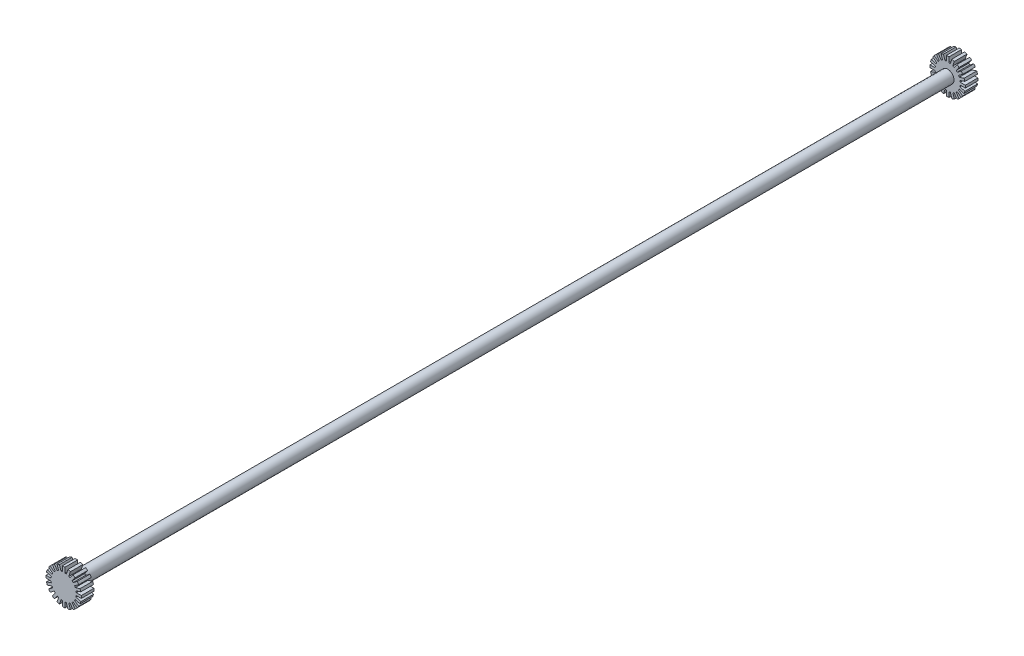
from build123d import *

# Parameters (mm, degrees)
SKETCH1_R           = 0.75
BOSS_EXTRUDE1_DEPTH = 0.5
SKETCH2_R           = 0.25
BOSS_EXTRUDE2_DEPTH = 34.5
SKETCH3_R           = 0.75
BOSS_EXTRUDE3_DEPTH = 0.5
SKETCH4_R           = 0.86249455
CUT_EXTRUDE1_DEPTH  = 42
SKETCH5_R           = 1.112534971
SKETCH5_R_2         = 0.7
CUT_EXTRUDE2_DEPTH  = 51


with BuildPart() as part:
    # Sketch1 → Boss-Extrude1 (new body)
    with BuildSketch(Plane.XY):
        Circle(SKETCH1_R)
    extrude(amount=BOSS_EXTRUDE1_DEPTH)

    # Sketch2 → Boss-Extrude2 (add)
    with BuildSketch(Plane.XY.offset(0.5)):
        Circle(SKETCH2_R)
    extrude(amount=BOSS_EXTRUDE2_DEPTH)

    # Sketch3 → Boss-Extrude3 (add)
    with BuildSketch(Plane.XY.offset(35)):
        Circle(SKETCH3_R)
    extrude(amount=BOSS_EXTRUDE3_DEPTH)

    # Sketch4 → Cut-Extrude1 (cut)
    with BuildSketch(Plane.XY.offset(35.5)):
        Circle(SKETCH4_R)
        with BuildLine():
            Line((-0.05, 0.75), (0.05, 0.75))
            Line((0.05, 0.75), (0.05, 0.497493719))
            ThreePointArc((0.05, 0.497493719), (0.078217233, 0.49384417), (0.106181188, 0.488595493))
            Line((0.106181188, 0.488595493), (0.18420992, 0.728743237))
            Line((0.18420992, 0.728743237), (0.279315572, 0.697841538))
            Line((0.279315572, 0.697841538), (0.201286839, 0.457693793))
            ThreePointArc((0.201286839, 0.457693793), (0.22699525, 0.445503262), (0.251968621, 0.431870136))
            Line((0.251968621, 0.431870136), (0.40038809, 0.636152008))
            Line((0.40038809, 0.636152008), (0.481289789, 0.577373483))
            Line((0.481289789, 0.577373483), (0.332870321, 0.37309161))
            ThreePointArc((0.332870321, 0.37309161), (0.353553391, 0.353553391), (0.37309161, 0.332870321))
            Line((0.37309161, 0.332870321), (0.577373483, 0.481289789))
            Line((0.577373483, 0.481289789), (0.636152008, 0.40038809))
            Line((0.636152008, 0.40038809), (0.431870136, 0.251968621))
            ThreePointArc((0.431870136, 0.251968621), (0.445503262, 0.22699525), (0.457693793, 0.201286839))
            Line((0.457693793, 0.201286839), (0.697841538, 0.279315572))
            Line((0.697841538, 0.279315572), (0.728743237, 0.18420992))
            Line((0.728743237, 0.18420992), (0.488595493, 0.106181188))
            ThreePointArc((0.488595493, 0.106181188), (0.49384417, 0.078217233), (0.497493719, 0.05))
            Line((0.497493719, 0.05), (0.75, 0.05))
            Line((0.75, 0.05), (0.75, -0.05))
            Line((0.75, -0.05), (0.497493719, -0.05))
            ThreePointArc((0.497493719, -0.05), (0.49384417, -0.078217233), (0.488595493, -0.106181188))
            Line((0.488595493, -0.106181188), (0.728743237, -0.18420992))
            Line((0.728743237, -0.18420992), (0.697841538, -0.279315572))
            Line((0.697841538, -0.279315572), (0.457693793, -0.201286839))
            ThreePointArc((0.457693793, -0.201286839), (0.445503262, -0.22699525), (0.431870136, -0.251968621))
            Line((0.431870136, -0.251968621), (0.636152008, -0.40038809))
            Line((0.636152008, -0.40038809), (0.577373483, -0.481289789))
            Line((0.577373483, -0.481289789), (0.37309161, -0.332870321))
            ThreePointArc((0.37309161, -0.332870321), (0.353553391, -0.353553391), (0.332870321, -0.37309161))
            Line((0.332870321, -0.37309161), (0.481289789, -0.577373483))
            Line((0.481289789, -0.577373483), (0.40038809, -0.636152008))
            Line((0.40038809, -0.636152008), (0.251968621, -0.431870136))
            ThreePointArc((0.251968621, -0.431870136), (0.22699525, -0.445503262), (0.201286839, -0.457693793))
            Line((0.201286839, -0.457693793), (0.279315572, -0.697841538))
            Line((0.279315572, -0.697841538), (0.18420992, -0.728743237))
            Line((0.18420992, -0.728743237), (0.106181188, -0.488595493))
            ThreePointArc((0.106181188, -0.488595493), (0.078217233, -0.49384417), (0.05, -0.497493719))
            Line((0.05, -0.497493719), (0.05, -0.75))
            Line((0.05, -0.75), (-0.05, -0.75))
            Line((-0.05, -0.75), (-0.05, -0.497493719))
            ThreePointArc((-0.05, -0.497493719), (-0.078217233, -0.49384417), (-0.106181188, -0.488595493))
            Line((-0.106181188, -0.488595493), (-0.18420992, -0.728743237))
            Line((-0.18420992, -0.728743237), (-0.279315572, -0.697841538))
            Line((-0.279315572, -0.697841538), (-0.201286839, -0.457693793))
            ThreePointArc((-0.201286839, -0.457693793), (-0.22699525, -0.445503262), (-0.251968621, -0.431870136))
            Line((-0.251968621, -0.431870136), (-0.40038809, -0.636152008))
            Line((-0.40038809, -0.636152008), (-0.481289789, -0.577373483))
            Line((-0.481289789, -0.577373483), (-0.332870321, -0.37309161))
            ThreePointArc((-0.332870321, -0.37309161), (-0.353553391, -0.353553391), (-0.37309161, -0.332870321))
            Line((-0.37309161, -0.332870321), (-0.577373483, -0.481289789))
            Line((-0.577373483, -0.481289789), (-0.636152008, -0.40038809))
            Line((-0.636152008, -0.40038809), (-0.431870136, -0.251968621))
            ThreePointArc((-0.431870136, -0.251968621), (-0.445503262, -0.22699525), (-0.457693793, -0.201286839))
            Line((-0.457693793, -0.201286839), (-0.697841538, -0.279315572))
            Line((-0.697841538, -0.279315572), (-0.728743237, -0.18420992))
            Line((-0.728743237, -0.18420992), (-0.488595493, -0.106181188))
            ThreePointArc((-0.488595493, -0.106181188), (-0.49384417, -0.078217233), (-0.497493719, -0.05))
            Line((-0.497493719, -0.05), (-0.75, -0.05))
            Line((-0.75, -0.05), (-0.75, 0.05))
            Line((-0.75, 0.05), (-0.497493719, 0.05))
            ThreePointArc((-0.497493719, 0.05), (-0.49384417, 0.078217233), (-0.488595493, 0.106181188))
            Line((-0.488595493, 0.106181188), (-0.728743237, 0.18420992))
            Line((-0.728743237, 0.18420992), (-0.697841538, 0.279315572))
            Line((-0.697841538, 0.279315572), (-0.457693793, 0.201286839))
            ThreePointArc((-0.457693793, 0.201286839), (-0.445503262, 0.22699525), (-0.431870136, 0.251968621))
            Line((-0.431870136, 0.251968621), (-0.636152008, 0.40038809))
            Line((-0.636152008, 0.40038809), (-0.577373483, 0.481289789))
            Line((-0.577373483, 0.481289789), (-0.37309161, 0.332870321))
            ThreePointArc((-0.37309161, 0.332870321), (-0.353553391, 0.353553391), (-0.332870321, 0.37309161))
            Line((-0.332870321, 0.37309161), (-0.481289789, 0.577373483))
            Line((-0.481289789, 0.577373483), (-0.40038809, 0.636152008))
            Line((-0.40038809, 0.636152008), (-0.251968621, 0.431870136))
            ThreePointArc((-0.251968621, 0.431870136), (-0.22699525, 0.445503262), (-0.201286839, 0.457693793))
            Line((-0.201286839, 0.457693793), (-0.279315572, 0.697841538))
            Line((-0.279315572, 0.697841538), (-0.18420992, 0.728743237))
            Line((-0.18420992, 0.728743237), (-0.106181188, 0.488595493))
            ThreePointArc((-0.106181188, 0.488595493), (-0.078217233, 0.49384417), (-0.05, 0.497493719))
            Line((-0.05, 0.497493719), (-0.05, 0.75))
        make_face(mode=Mode.SUBTRACT)
    extrude(amount=-CUT_EXTRUDE1_DEPTH, mode=Mode.SUBTRACT)

    # Sketch5 → Cut-Extrude2 (cut)
    with BuildSketch(Plane(origin=(0, 0, 0), x_dir=(-1, 0, 0), z_dir=(0, 0, -1))):
        Circle(SKETCH5_R)
        Circle(SKETCH5_R_2, mode=Mode.SUBTRACT)
    extrude(amount=-CUT_EXTRUDE2_DEPTH, mode=Mode.SUBTRACT)


solid = part.part
